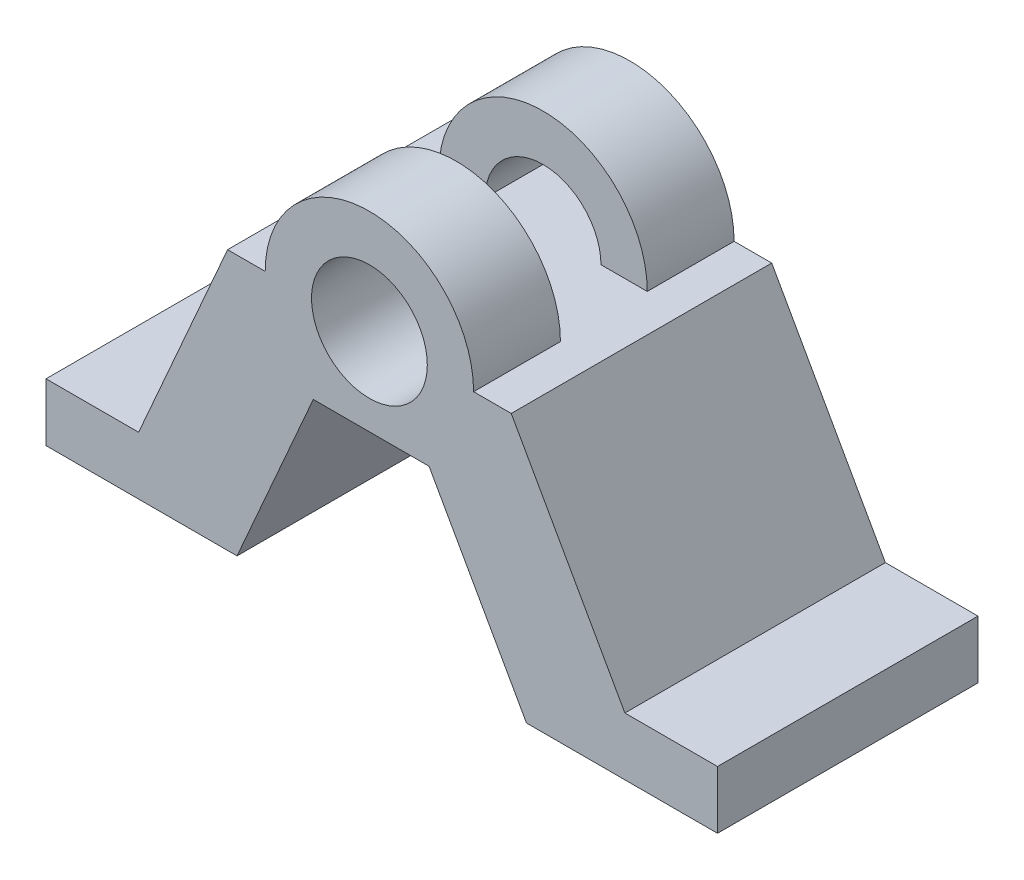
from build123d import *

# Parameters (mm, degrees)
BOSS_EXTRUDE2_DEPTH = 30
BOSS_EXTRUDE4_DEPTH = 15
CUT_EXTRUDE1_DEPTH  = 94.941606783
CUT_EXTRUDE2_DEPTH  = 15


with BuildPart() as part:
    # Sketch1 → Boss-Extrude2 (new body)
    with BuildSketch(Plane.XY):
        Polygon((52.825436409, -10), (52.825436409, 0), (36.825436409, 0), (17.193398817, 35), (-31.806601183, 35), (-47.174563591, 0), (-63.174563591, 0), (-63.174563591, -10), (-30.174563591, -10), (-17.002024384, 20), (2.997975616, 20), (19.825436409, -10), align=None)
    boss_extrude2 = extrude(amount=-BOSS_EXTRUDE2_DEPTH)

    # Sketch4 → Boss-Extrude4 (add)
    with BuildSketch(Plane.XY):
        with BuildLine():
            ThreePointArc((10.693398817, 35), (-7.306601183, 53), (-25.306601183, 35))
            Line((-25.306601183, 35), (10.693398817, 35))
        make_face()
    boss_extrude4 = extrude(amount=-BOSS_EXTRUDE4_DEPTH)

    # Mirror1: Boss-Extrude2, Boss-Extrude4 across plane
    add(boss_extrude2.mirror(Plane(origin=(0, 0, -22.5), x_dir=(1, 0, 0), z_dir=(0, 0, -1))))
    add(boss_extrude4.mirror(Plane(origin=(0, 0, -22.5), x_dir=(1, 0, 0), z_dir=(0, 0, -1))))

    # Sketch5 → Cut-Extrude1 (cut, through all)
    with BuildSketch(Plane.XY):
        with BuildLine():
            ThreePointArc((2.693398817, 35), (-7.306601183, 45), (-17.306601183, 35))
            Line((-17.306601183, 35), (2.693398817, 35))
        make_face()
    extrude(amount=-CUT_EXTRUDE1_DEPTH, mode=Mode.SUBTRACT)

    # Sketch6 → Cut-Extrude2 (cut)
    with BuildSketch(Plane.XY):
        with BuildLine():
            ThreePointArc((2.693398817, 35), (-7.306601183, 45), (-17.306601183, 35))
            Line((-17.306601183, 35), (2.693398817, 35))
        make_face()
        with BuildLine():
            Line((2.693398817, 35), (-17.306601183, 35))
            ThreePointArc((-17.306601183, 35), (-7.306601183, 25), (2.693398817, 35))
        make_face()
    extrude(amount=-CUT_EXTRUDE2_DEPTH, mode=Mode.SUBTRACT)


solid = part.part
